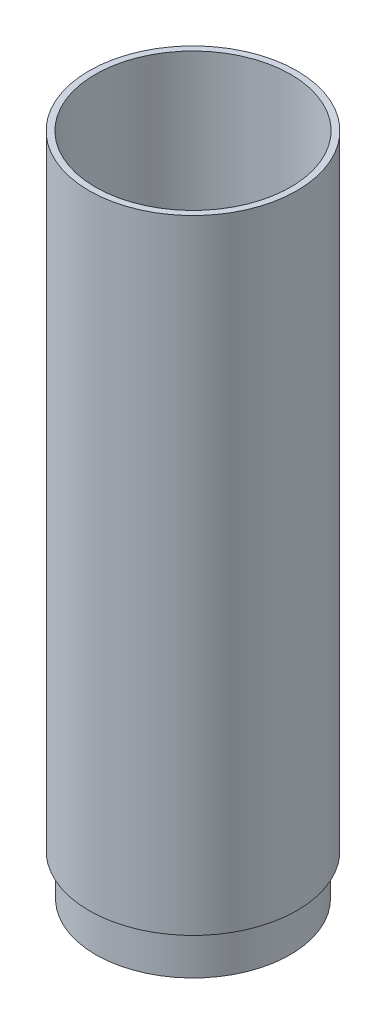
from build123d import *

# Parameters (mm, degrees)
ESQUISSE1_R        = 25
ESQUISSE1_R_2      = 23.5
BOSS_EXTRU_1_DEPTH = 42
ESQUISSE4_R        = 25
ESQUISSE4_R_2      = 20
BOSS_EXTRU_4_DEPTH = 3
ESQUISSE5_R        = 25
ESQUISSE5_R_2      = 23.5
BOSS_EXTRU_5_DEPTH = 95
BOSS_EXTRU_6_START = 10
ESQUISSE7_R        = 25
ESQUISSE7_R_2      = 21.5
BOSS_EXTRU_6_DEPTH = 10
BOSS_EXTRU_7_START = 10
ESQUISSE8_R        = 23.4
ESQUISSE8_R_2      = 21.5
BOSS_EXTRU_7_DEPTH = 10


with BuildPart() as part:
    # Esquisse1 → Boss.-Extru.1 (new body)
    with BuildSketch(Plane(origin=(0, 0, 0), x_dir=(1, 0, 0), z_dir=(0, 1, 0))):
        with Locations(Location((0, 0, 0), (0, 0, 90))):
            Circle(ESQUISSE1_R)
        with Locations(Location((0, 0, 0), (0, 0, 90))):
            Circle(ESQUISSE1_R_2, mode=Mode.SUBTRACT)
    extrude(amount=BOSS_EXTRU_1_DEPTH)

    # Esquisse4 → Boss.-Extru.4 (add)
    with BuildSketch(Plane(origin=(0, 42, 0), x_dir=(1, 0, 0), z_dir=(0, 1, 0))):
        with Locations(Location((0, 0, 0), (0, 0, 90))):
            Circle(ESQUISSE4_R)
        with Locations(Location((0, 0, 0), (0, 0, 270))):
            Circle(ESQUISSE4_R_2, mode=Mode.SUBTRACT)
    extrude(amount=BOSS_EXTRU_4_DEPTH)

    # Esquisse5 → Boss.-Extru.5 (add)
    with BuildSketch(Plane(origin=(0, 45, 0), x_dir=(1, 0, 0), z_dir=(0, 1, 0))):
        with Locations(Location((0, 0, 0), (0, 0, 90))):
            Circle(ESQUISSE5_R)
        with Locations(Location((0, 0, 0), (0, 0, 90))):
            Circle(ESQUISSE5_R_2, mode=Mode.SUBTRACT)
    extrude(amount=BOSS_EXTRU_5_DEPTH)

    # Esquisse7 → Boss.-Extru.6 (add)
    with BuildSketch(Plane.XZ.offset(BOSS_EXTRU_6_START)):
        with Locations(Location((0, 0, 0), (0, 0, 270))):
            Circle(ESQUISSE7_R)
        with Locations(Location((0, 0, 0), (0, 0, 270))):
            Circle(ESQUISSE7_R_2, mode=Mode.SUBTRACT)
    extrude(amount=-BOSS_EXTRU_6_DEPTH)

    # Esquisse8 → Boss.-Extru.7 (add)
    with BuildSketch(Plane.XZ.offset(10).offset(BOSS_EXTRU_7_START)):
        with Locations(Location((0, 0, 0), (0, 0, 270))):
            Circle(ESQUISSE8_R)
        with Locations(Location((0, 0, 0), (0, 0, 270))):
            Circle(ESQUISSE8_R_2, mode=Mode.SUBTRACT)
    extrude(amount=-BOSS_EXTRU_7_DEPTH)


solid = part.part
